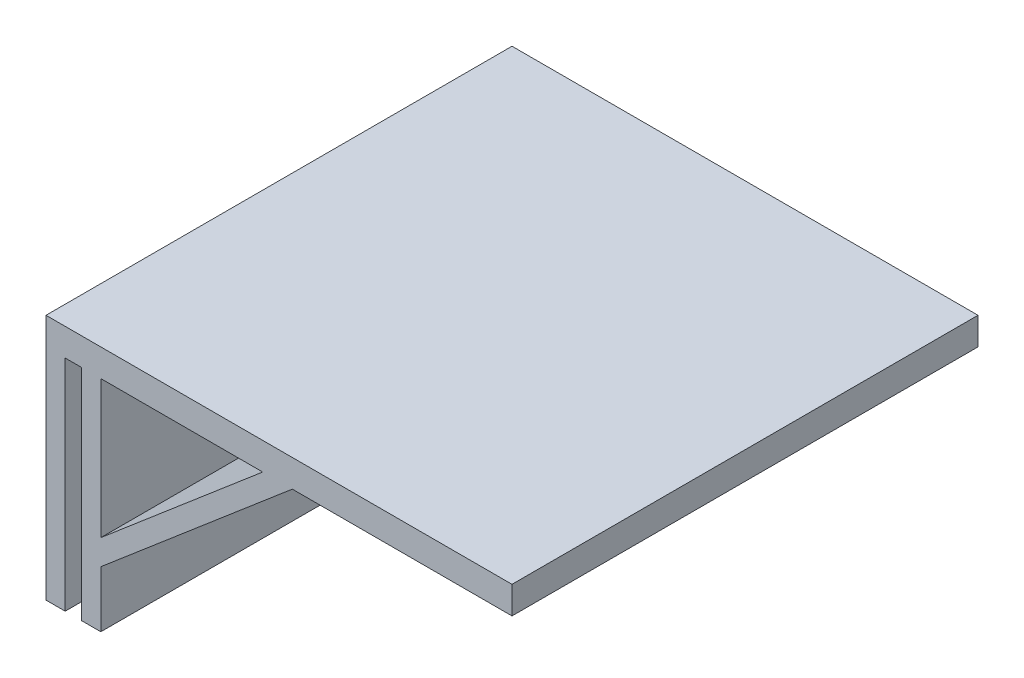
from build123d import *

# Parameters (mm, degrees)
BOSS_EXTRU_1_DEPTH      = 170
ENL_V_MAT_EXTRU_1_DEPTH = 257.70995306


with BuildPart() as part:
    # Esquisse1 → Boss.-Extru.1 (new body)
    with BuildSketch(Plane.XY):
        Polygon((0, 90), (0, 0), (7, 0), (7, 80), (13, 80), (13, 0), (20, 0), (20, 20.562593983), (89.86150576, 80), (170, 80), (170, 90), align=None)
    extrude(amount=BOSS_EXTRU_1_DEPTH)

    # Esquisse3 → Enlèv. mat.-Extru.1 (cut, through all)
    with BuildSketch(Plane.XY.offset(170)):
        Polygon((20, 80), (79.058990958, 80), (20, 29.753255583), align=None)
    extrude(amount=-ENL_V_MAT_EXTRU_1_DEPTH, mode=Mode.SUBTRACT)


solid = part.part
